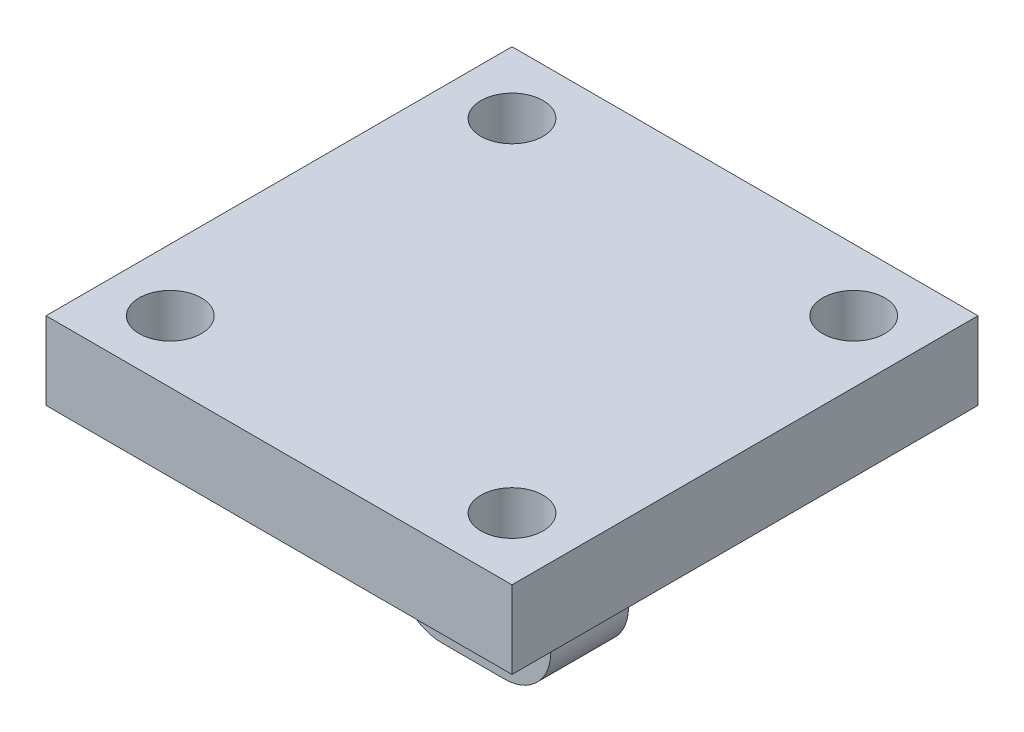
from build123d import *

# Parameters (mm, degrees)
SKETCH2_W           = 10
SKETCH2_H           = 18
SKETCH2_R           = 2
BOSS_EXTRUDE1_DEPTH = 5
SKETCH3_W           = 30
SKETCH3_H           = 30
BOSS_EXTRUDE2_DEPTH = 5
FILLET1_R           = 5
FILLET2_R           = 3
SKETCH4_R           = 2
CUT_EXTRUDE1_DEPTH  = 5


with BuildPart() as part:
    # Sketch2 → Boss-Extrude1 (new body)
    with BuildSketch(Plane.XY):
        with Locations((-5, 9)):
            Rectangle(SKETCH2_W, SKETCH2_H)
        with Locations((-5, 4.24)):
            Circle(SKETCH2_R, mode=Mode.SUBTRACT)
    extrude(amount=BOSS_EXTRUDE1_DEPTH)

    # Sketch3 → Boss-Extrude2 (add)
    with BuildSketch(Plane(origin=(0, 18, 0), x_dir=(1, 0, 0), z_dir=(0, 1, 0))):
        with Locations((-5, -2.5)):
            Rectangle(SKETCH3_W, SKETCH3_H)
    extrude(amount=-BOSS_EXTRUDE2_DEPTH)

    # Fillet1
    fillet1_edges = [part.edges().sort_by_distance(p)[0] for p in [
        (0, 13, 2.5),
        (-10, 13, 2.5),
    ]]
    fillet(fillet1_edges, radius=FILLET1_R)

    # Fillet2
    fillet2_edges = [part.edges().sort_by_distance(p)[0] for p in [
        (0, 0, 2.5),
        (-10, 0, 2.5),
    ]]
    fillet(fillet2_edges, radius=FILLET2_R)

    # Sketch4 → Cut-Extrude1 (cut)
    with BuildSketch(Plane(origin=(0, 18, 0), x_dir=(1, 0, 0), z_dir=(0, 1, 0))):
        with Locations(Location((-16, 8.5, 0), (0, 0, 270))):
            Circle(SKETCH4_R)
        with Locations(Location((6, 8.5, 0), (0, 0, 270))):
            Circle(SKETCH4_R)
        with Locations(Location((6, -13.5, 0), (0, 0, 270))):
            Circle(SKETCH4_R)
        with Locations(Location((-16, -13.5, 0), (0, 0, 270))):
            Circle(SKETCH4_R)
    extrude(amount=-CUT_EXTRUDE1_DEPTH, mode=Mode.SUBTRACT)


solid = part.part
